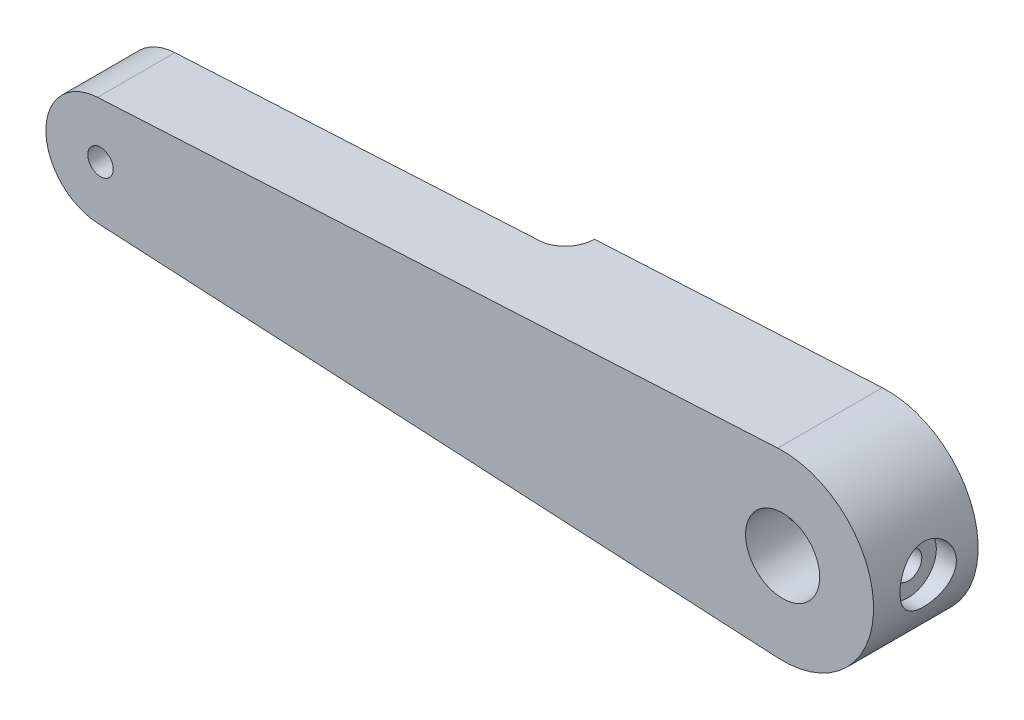
from build123d import *

# Parameters (mm, degrees)
SKETCH_1_R               = 1.400000008
SKETCH_1_R_2             = 4.074999999
EXTRUDE_1_DEPTH          = 11.500000001
SKETCH_2_R               = 1.499999995
CUT_EXTRUDE_1_DEPTH      = 52.126386943
CUT_EXTRUDE_START        = 40
SKETCH_2_3_R             = 3.099999995
CUT_EXTRUDE_2_DEPTH      = 12.126386986
CUT_EXTRUDE_3_DEPTH      = 52.126386986
CUT_EXTRUDE_3_DEPTH_BACK = 52.126386986
SKETCH_4_R               = 2.999999992
CUT_EXTRUDE_4_DEPTH      = 2.5


with BuildPart() as part:
    # Эскиз1 → Бобышка-Вытянуть1 (new body)
    with BuildSketch(Plane.XY):
        with BuildLine():
            Line((-43.122227837, -5.991460588), (31.66443883, -9.985767648))
            ThreePointArc((31.66443883, -9.985767648), (42.197772163, 2e-09), (31.66443883, 9.985767652))
            Line((31.66443883, 9.985767652), (-43.122227837, 5.991460592))
            ThreePointArc((-43.122227837, 5.991460592), (-48.802227837, 2e-09), (-43.122227837, -5.991460588))
        make_face()
        with Locations((-42.802227837, 2e-09)):
            Circle(SKETCH_1_R, mode=Mode.SUBTRACT)
        with Locations((32.197772163, 2e-09)):
            Circle(SKETCH_1_R_2, mode=Mode.SUBTRACT)
    extrude(amount=-EXTRUDE_1_DEPTH)

    # Эскиз2 → Вырез-Вытянуть1 (cut, through all)
    with BuildSketch(Plane(origin=(0, 0, 0), x_dir=(0, 0, -1), z_dir=(1, 0, 0))):
        with Locations(Location((6, 6e-09, 0), (0, 0, 180))):
            Circle(SKETCH_2_R)
    extrude(amount=CUT_EXTRUDE_1_DEPTH, mode=Mode.SUBTRACT)

    # Эскиз2<3> → Вырез-Вытянуть2 (cut, through all)
    with BuildSketch(Plane(origin=(0, 0, 0), x_dir=(0, 0, -1), z_dir=(1, 0, 0)).offset(CUT_EXTRUDE_START)):
        with Locations(Location((6, 6e-09, 0), (0, 0, 180))):
            Circle(SKETCH_2_3_R)
    extrude(amount=CUT_EXTRUDE_2_DEPTH, mode=Mode.SUBTRACT)

    # Эскиз3 → Вырез-Вытянуть3 (cut, two sides: drawn at the far end of the back side and taken through both)
    with BuildSketch(Plane(origin=(0, 0, 0), x_dir=(1, 0, 0), z_dir=(0, 1, 0)).offset(-CUT_EXTRUDE_3_DEPTH_BACK)):
        with BuildLine():
            Line((-57.148549842, 26.385379488), (0, 26.385379488))
            Line((0, 26.385379488), (0, 11.5))
            ThreePointArc((0, 11.5), (-0.878679656, 9.378679656), (-3, 8.5))
            Line((-3, 8.5), (-57.148549842, 8.5))
            Line((-57.148549842, 8.5), (-57.148549842, 26.385379488))
        make_face()
    extrude(amount=CUT_EXTRUDE_3_DEPTH + CUT_EXTRUDE_3_DEPTH_BACK, mode=Mode.SUBTRACT)

    # Эскиз4 → Вырез-Вытянуть4 (cut)
    with BuildSketch(Plane(origin=(0, 0, -8.5), x_dir=(-1, 0, 0), z_dir=(0, 0, -1))):
        with Locations((42.802227837, 2e-09)):
            Circle(SKETCH_4_R)
    extrude(amount=-CUT_EXTRUDE_4_DEPTH, mode=Mode.SUBTRACT)


solid = part.part
